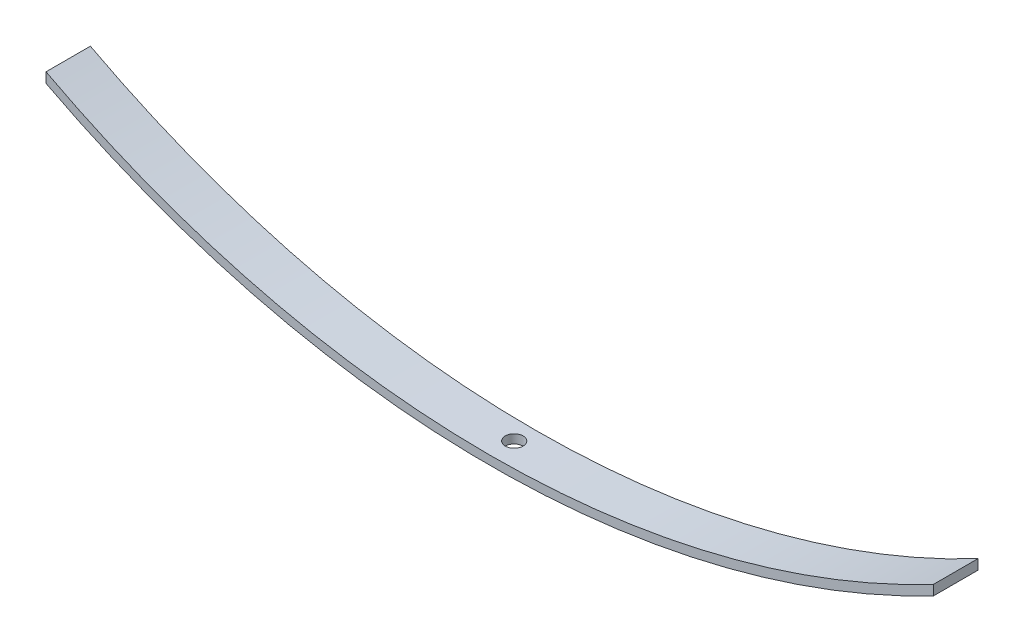
from build123d import *

# Parameters (mm, degrees)
BOSS_EXTRUDE1_DEPTH = 50
SKETCH3_R           = 10
CUT_EXTRUDE1_DEPTH  = 1192.175889615


with BuildPart() as part:
    # Sketch1 → Boss-Extrude1 (new body)
    with BuildSketch(Plane.XY):
        with BuildLine():
            Line((-500, -957.287835502), (-500, -945.991543303))
            ThreePointArc((-500, -945.991543303), (0, -1070), (500, -945.991543303))
            Line((500, -945.991543303), (500, -957.287835502))
            ThreePointArc((500, -957.287835502), (0, -1080), (-500, -957.287835502))
        make_face()
    extrude(amount=BOSS_EXTRUDE1_DEPTH)

    # Sketch3 → Cut-Extrude1 (cut, through all)
    with BuildSketch(Plane(origin=(0, 0, 0), x_dir=(1, 0, 0), z_dir=(0, 1, 0))):
        with Locations(Location((0, -22.5, 0), (0, 0, 270))):
            Circle(SKETCH3_R)
    extrude(amount=-CUT_EXTRUDE1_DEPTH, mode=Mode.SUBTRACT)


solid = part.part
